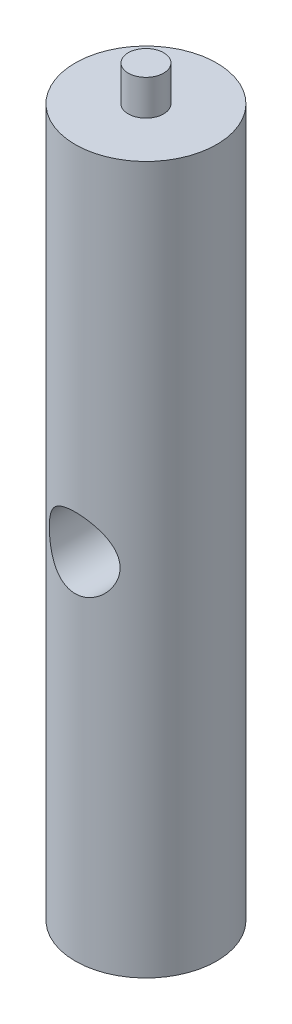
from build123d import *

# Parameters (mm, degrees)
SKETCH1_R               = 20
BOSS_EXTRUDE1_DEPTH     = 200
CUT_EXTRUDE1_DEPTH      = 202.990098767
CUT_EXTRUDE1_DEPTH_BACK = 200
SKETCH2_R               = 10
SKETCH5_R               = 5
BOSS_EXTRUDE4_DEPTH     = 10


with BuildPart() as part:
    # Sketch1 → Boss-Extrude1 (new body)
    with BuildSketch(Plane(origin=(0, 0, 0), x_dir=(1, 0, 0), z_dir=(0, 1, 0))):
        with Locations(Location((0, 0, 0), (0, 0, 270))):
            Circle(SKETCH1_R)
    extrude(amount=BOSS_EXTRUDE1_DEPTH)

    # Sketch2 → Cut-Extrude1 (cut, two sides: drawn at the far end of the back side and taken through both)
    with BuildSketch(Plane.XY.offset(-CUT_EXTRUDE1_DEPTH_BACK)):
        with Locations(Location((0, 100, 0), (0, 0, 90))):
            Circle(SKETCH2_R)
    extrude(amount=CUT_EXTRUDE1_DEPTH + CUT_EXTRUDE1_DEPTH_BACK, mode=Mode.SUBTRACT)

    # Sketch5 → Boss-Extrude4 (add)
    with BuildSketch(Plane(origin=(0, 200, 0), x_dir=(1, 0, 0), z_dir=(0, 1, 0))):
        with Locations(Location((0, 0, 0), (0, 0, 270))):
            Circle(SKETCH5_R)
    extrude(amount=BOSS_EXTRUDE4_DEPTH)


solid = part.part
